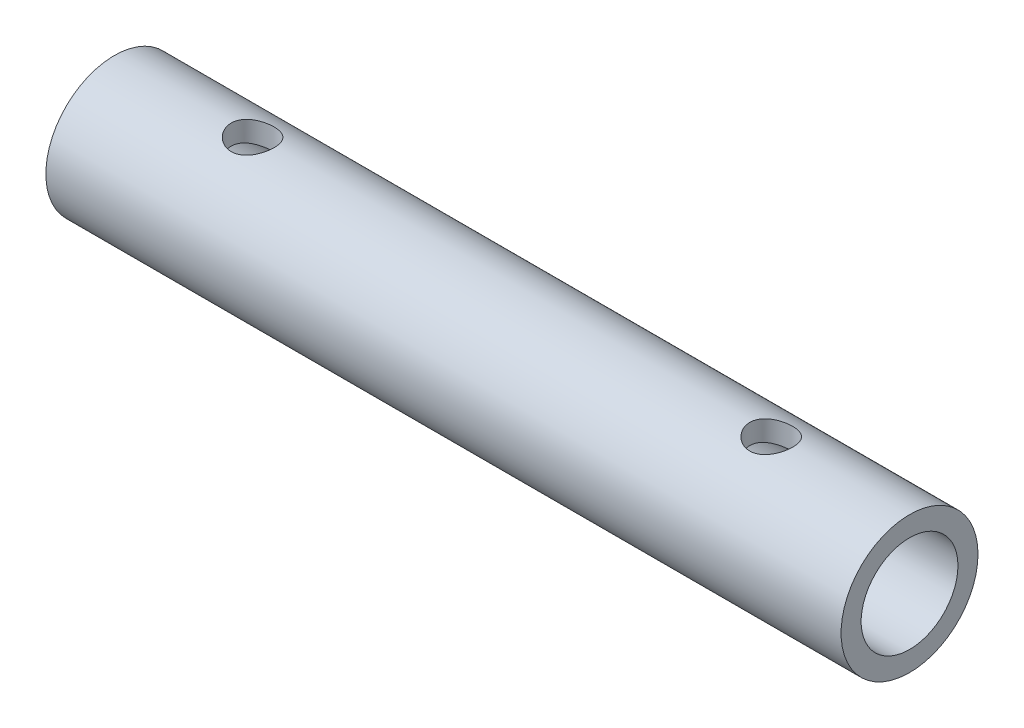
from build123d import *

# Parameters (mm, degrees)
SKETCH_1_R               = 9.9
SKETCH_1_R_2             = 7
EXTRUDE_1_DEPTH          = 115
CUT_EXTRUDE_1_DEPTH      = 116.849126022
CUT_EXTRUDE_1_DEPTH_BACK = 116.849126022
SKETCH_2_R               = 3.1


with BuildPart() as part:
    # 草图1 → 凸台-拉伸1 (new body)
    with BuildSketch(Plane(origin=(0, 0, 0), x_dir=(0, 0, -1), z_dir=(1, 0, 0))):
        Circle(SKETCH_1_R)
        Circle(SKETCH_1_R_2, mode=Mode.SUBTRACT)
    extrude(amount=EXTRUDE_1_DEPTH)

    # 草图2 → 切除-拉伸1 (cut, two sides: drawn at the far end of the back side and taken through both)
    with BuildSketch(Plane(origin=(0, 0, 0), x_dir=(1, 0, 0), z_dir=(0, 1, 0)).offset(-CUT_EXTRUDE_1_DEPTH_BACK)):
        with Locations(Location((20, 0, 0), (0, 0, 270))):
            Circle(SKETCH_2_R)
        with Locations(Location((95, 0, 0), (0, 0, 270))):
            Circle(SKETCH_2_R)
    extrude(amount=CUT_EXTRUDE_1_DEPTH + CUT_EXTRUDE_1_DEPTH_BACK, mode=Mode.SUBTRACT)


solid = part.part
